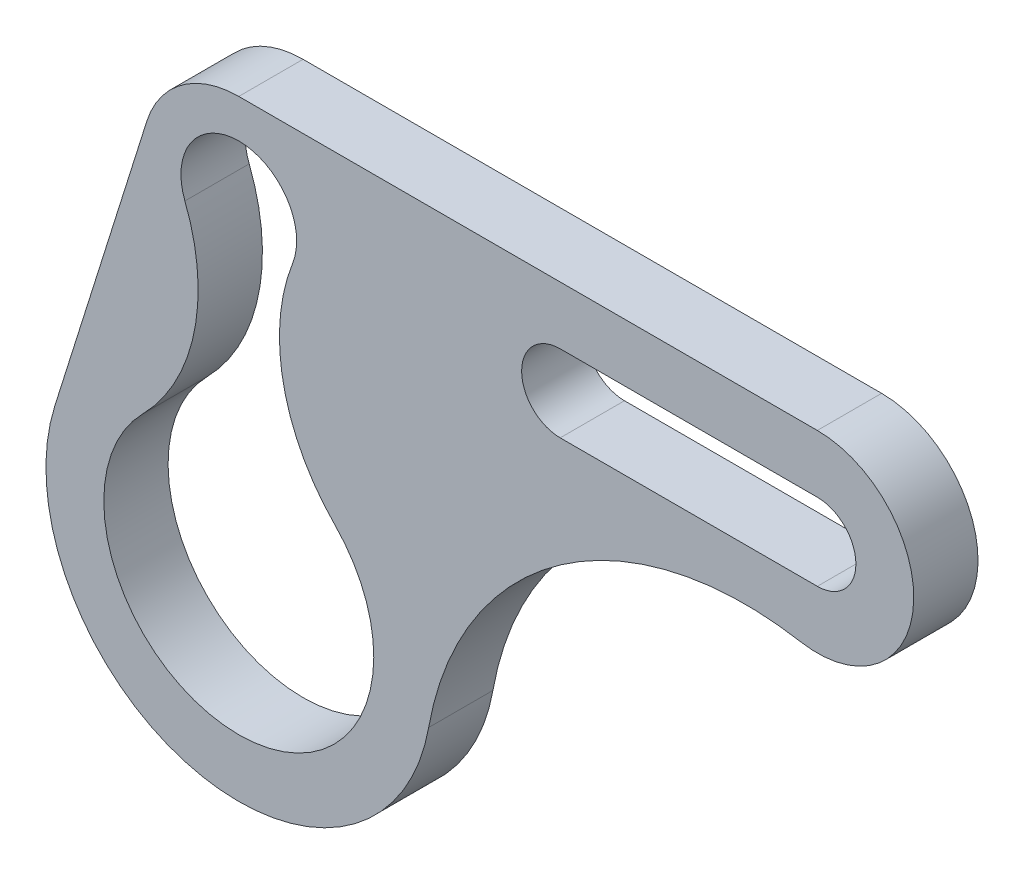
from build123d import *

# Parameters (mm, degrees)
BOSS_EXTRUDE1_DEPTH = 5


with BuildPart() as part:
    # Sketch1 → Boss-Extrude1 (new, symmetric)
    with BuildSketch(Plane.XY):
        with BuildLine():
            Line((0, 65), (90, 65))
            ThreePointArc((90, 65), (104.943418217, 48.698365648), (87.406551135, 35.225900265))
            ThreePointArc((87.406551135, 35.225900265), (50.100874494, 26.949083525), (29.535645594, -5.25791207))
            ThreePointArc((29.535645594, -5.25791207), (-7.143700144, -29.137047693), (-28.618176043, 9))
            Line((-28.618176043, 9), (-14.309088021, 54.5))
            ThreePointArc((-14.309088021, 54.5), (-8.874119675, 62.093386622), (0, 65))
        make_face()
        with BuildLine():
            Line((50, 56), (90, 56))
            ThreePointArc((90, 56), (96, 50), (90, 44))
            Line((90, 44), (50, 44))
            ThreePointArc((50, 44), (44, 50), (50, 56))
        make_face(mode=Mode.SUBTRACT)
        with BuildLine():
            ThreePointArc((8.382229724, 46.723076923), (0, 59), (-8.382229724, 46.723076923))
            ThreePointArc((-8.382229724, 46.723076923), (-6.937432482, 29.759413292), (-14.956527547, 14.741176471))
            ThreePointArc((-14.956527547, 14.741176471), (0, -21), (14.956527547, 14.741176471))
            ThreePointArc((14.956527547, 14.741176471), (6.937432482, 29.759413292), (8.382229724, 46.723076923))
        make_face(mode=Mode.SUBTRACT)
    extrude(amount=BOSS_EXTRUDE1_DEPTH, both=True)


solid = part.part
